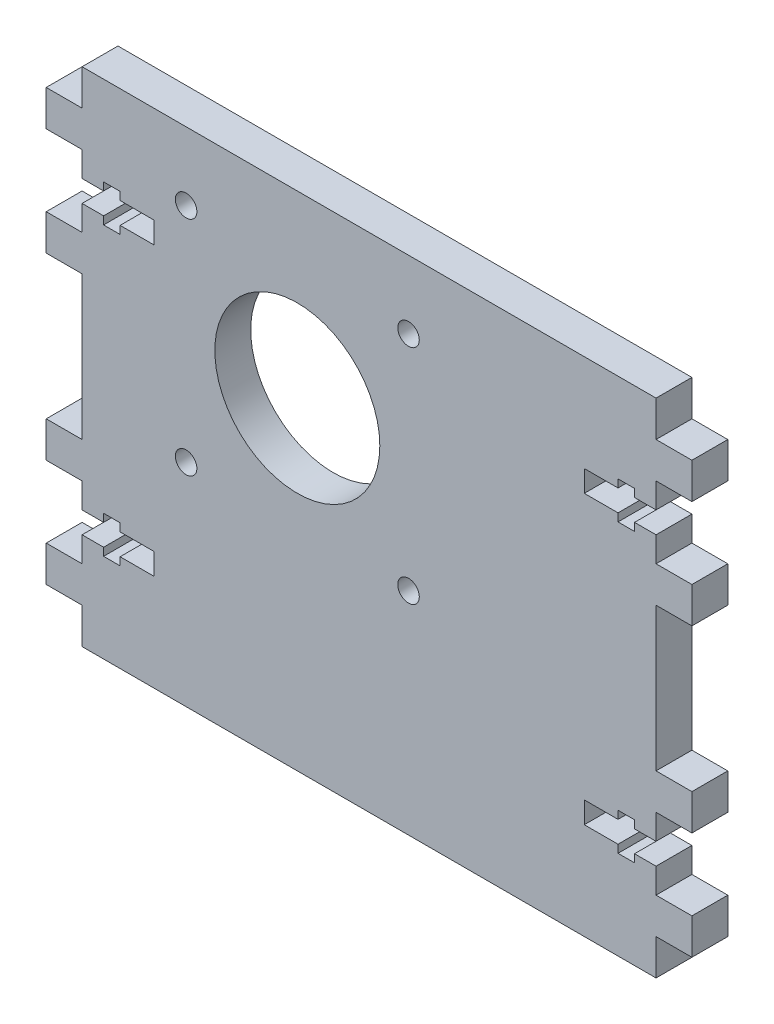
from build123d import *

# Parameters (mm, degrees)
SKETCH1_R           = 1.5
SKETCH1_R_2         = 11.5
BOSS_EXTRUDE1_DEPTH = 5


with BuildPart() as part:
    # Sketch1 → Boss-Extrude1 (new body)
    with BuildSketch(Plane.XY):
        Polygon((0, 70), (-80, 70), (-80, 65), (-85, 65), (-85, 60), (-80, 60), (-80, 56.5), (-77, 56.5), (-77, 57.6), (-74.7, 57.6), (-74.7, 56.5), (-70, 56.5), (-70, 53.5), (-74.7, 53.5), (-74.7, 52.4), (-77, 52.4), (-77, 53.5), (-80, 53.5), (-80, 50), (-85, 50), (-85, 45), (-80, 45), (-80, 25), (-85, 25), (-85, 20), (-80, 20), (-80, 16.5), (-77, 16.5), (-77, 17.6), (-74.7, 17.6), (-74.7, 16.5), (-70, 16.5), (-70, 13.5), (-74.7, 13.5), (-74.7, 12.4), (-77, 12.4), (-77, 13.5), (-80, 13.5), (-80, 10), (-85, 10), (-85, 5), (-80, 5), (-80, 0), (0, 0), (0, 5), (5, 5), (5, 10), (0, 10), (0, 13.5), (-3, 13.5), (-3, 12.4), (-5.3, 12.4), (-5.3, 13.5), (-10, 13.5), (-10, 16.5), (-5.3, 16.5), (-5.3, 17.6), (-3, 17.6), (-3, 16.5), (0, 16.5), (0, 20), (5, 20), (5, 25), (0, 25), (0, 45), (5, 45), (5, 50), (0, 50), (0, 53.5), (-3, 53.5), (-3, 52.4), (-5.3, 52.4), (-5.3, 53.5), (-10, 53.5), (-10, 56.5), (-5.3, 56.5), (-5.3, 57.6), (-3, 57.6), (-3, 56.5), (0, 56.5), (0, 60), (5, 60), (5, 65), (0, 65), align=None)
        with Locations((-65.5, 60.5)):
            Circle(SKETCH1_R, mode=Mode.SUBTRACT)
        with Locations((-34.5, 60.5)):
            Circle(SKETCH1_R, mode=Mode.SUBTRACT)
        with Locations((-34.5, 29.5)):
            Circle(SKETCH1_R, mode=Mode.SUBTRACT)
        with Locations((-65.5, 29.5)):
            Circle(SKETCH1_R, mode=Mode.SUBTRACT)
        with Locations((-50, 45)):
            Circle(SKETCH1_R_2, mode=Mode.SUBTRACT)
    extrude(amount=BOSS_EXTRUDE1_DEPTH)


solid = part.part
